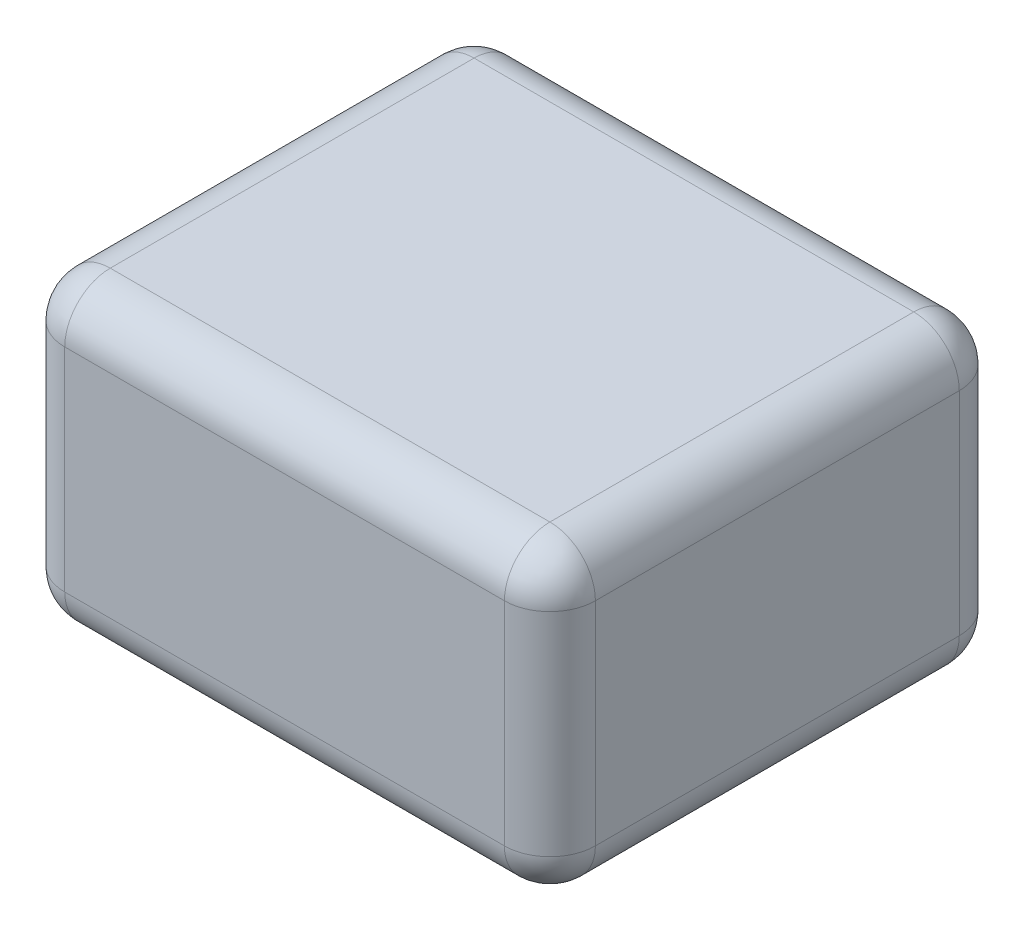
from build123d import *

# Parameters (mm, degrees)
SKETCH1_W           = 35
SKETCH1_H           = 20
BOSS_EXTRUDE1_DEPTH = 30
FILLET1_R           = 3


with BuildPart() as part:
    # Sketch1 → Boss-Extrude1 (new body)
    with BuildSketch(Plane.XY):
        with Locations((-99.091899354, -369.777465673)):
            Rectangle(SKETCH1_W, SKETCH1_H)
    extrude(amount=BOSS_EXTRUDE1_DEPTH)

    # Fillet1
    fillet1_edges = [part.edges().sort_by_distance(p)[0] for p in [
        (-81.591899354, -369.777465673, 30),
        (-99.091899354, -359.777465673, 30),
        (-116.591899354, -369.777465673, 30),
        (-99.091899354, -359.777465673, 0),
        (-81.591899354, -369.777465673, 0),
        (-99.091899354, -379.777465673, 0),
        (-116.591899354, -369.777465673, 0),
        (-116.591899354, -359.777465673, 15),
        (-81.591899354, -359.777465673, 15),
        (-81.591899354, -379.777465673, 15),
        (-116.591899354, -379.777465673, 15),
        (-99.091899354, -379.777465673, 30),
    ]]
    fillet(fillet1_edges, radius=FILLET1_R)


solid = part.part
